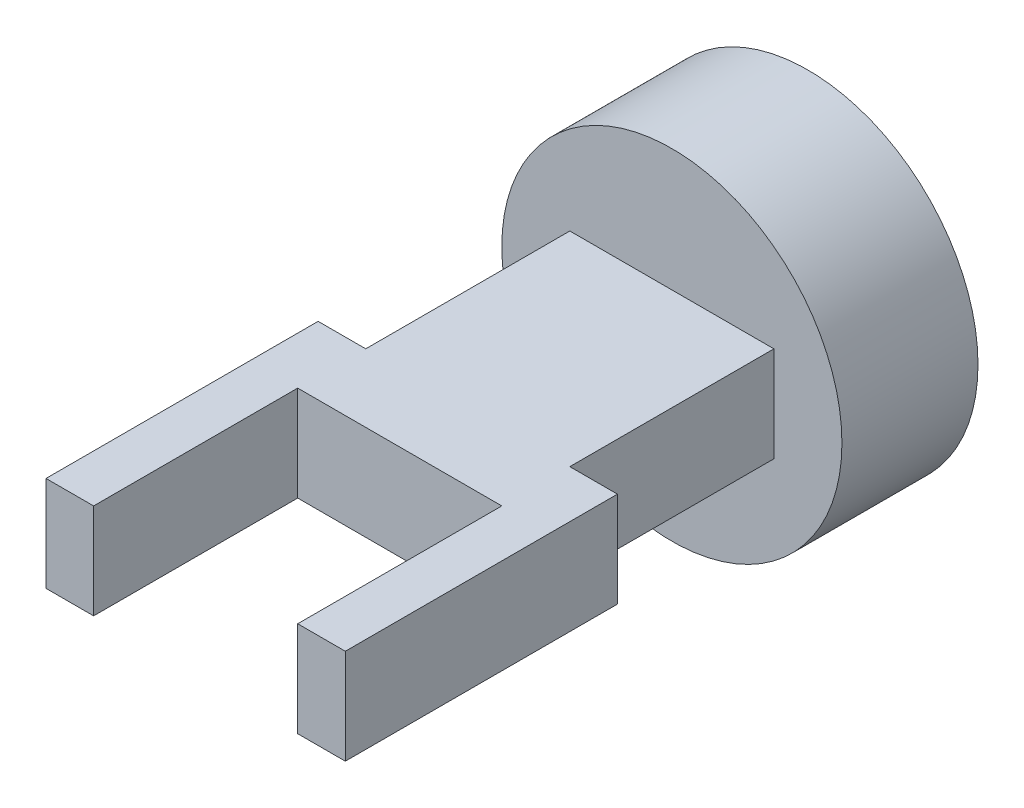
from build123d import *

# Parameters (mm, degrees)
SKETCH1_R             = 12.5
BOSS_EXTRUDE1_DEPTH   = 10
SKETCH2_W             = 15
SKETCH2_H             = 7
BOSS_EXTRUDE2_DEPTH   = 20
SKETCH3_W             = 3.5
SKETCH3_H             = 7
BOSS_EXTRUDE4_DEPTH   = 15
BOSS_EXTRUDE4_2_DEPTH = 15
SKETCH3_4_W           = 3.5
SKETCH3_4_H           = 7
BOSS_EXTRUDE5_DEPTH   = 5


with BuildPart() as part:
    # Sketch1 → Boss-Extrude1 (new body)
    with BuildSketch(Plane.XY):
        Circle(SKETCH1_R)
    extrude(amount=BOSS_EXTRUDE1_DEPTH)

    # Sketch2 → Boss-Extrude2 (add)
    with BuildSketch(Plane.XY.offset(10)):
        Rectangle(SKETCH2_W, SKETCH2_H)
    extrude(amount=BOSS_EXTRUDE2_DEPTH)



with BuildPart() as body_2:
    # Sketch3 → Boss-Extrude4 (new body)
    with BuildSketch(Plane.XY.offset(30)):
        with Locations((-9.25, 0)):
            Rectangle(SKETCH3_W, SKETCH3_H)
    extrude(amount=BOSS_EXTRUDE4_DEPTH)


with BuildPart() as body_3:
    # Sketch3 → Boss-Extrude4 2 (new body)
    with BuildSketch(Plane.XY.offset(30)):
        with Locations((9.25, 0)):
            Rectangle(SKETCH3_W, SKETCH3_H)
    extrude(amount=BOSS_EXTRUDE4_2_DEPTH)


with BuildPart() as part_1:
    add(part.part)

    add(body_2.part)  # Boss-Extrude5 merges body 2

    add(body_3.part)  # Boss-Extrude5 merges body 3
    # Sketch3<4> → Boss-Extrude5 (add)
    with BuildSketch(Plane.XY.offset(30)):
        with Locations((-9.25, 0)):
            Rectangle(SKETCH3_4_W, SKETCH3_4_H)
        with Locations((9.25, 0)):
            Rectangle(SKETCH3_4_W, SKETCH3_4_H)
    extrude(amount=-BOSS_EXTRUDE5_DEPTH)


solid = part_1.part
